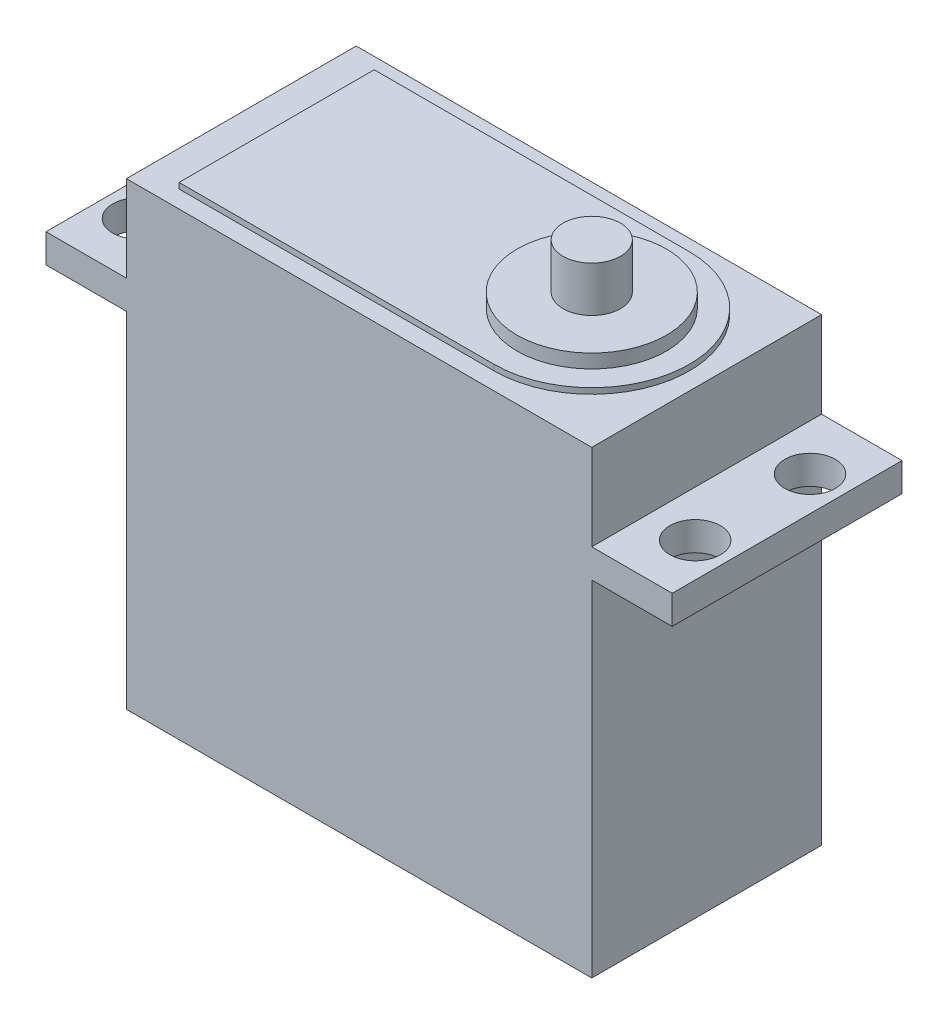
from build123d import *

# Parameters (mm, degrees)
SKETCH_1_W          = 40.5
SKETCH_1_H          = 20
EXTRUDE_1_DEPTH     = 30
SKETCH_2_W          = 54.5
SKETCH_2_H          = 20
EXTRUDE_2_DEPTH     = 2.5
SKETCH_3_W          = 40.5
SKETCH_3_H          = 20
EXTRUDE_3_DEPTH     = 7.5
EXTRUDE_4_DEPTH     = 0.5
SKETCH_5_R          = 6.5
EXTRUDE_5_DEPTH     = 1.2
SKETCH_6_R          = 2.5
EXTRUDE_6_DEPTH     = 3.95
SKETCH_7_R          = 2.2
CUT_EXTRUDE_1_DEPTH = 3.95


with BuildPart() as part:
    # 草图1 → 凸台-拉伸1 (new body)
    with BuildSketch(Plane(origin=(0, 0, 0), x_dir=(1, 0, 0), z_dir=(0, 1, 0))):
        with Locations((20.25, -10)):
            Rectangle(SKETCH_1_W, SKETCH_1_H)
    extrude(amount=EXTRUDE_1_DEPTH)

    # 草图2 → 凸台-拉伸2 (add)
    with BuildSketch(Plane(origin=(0, 30, 0), x_dir=(1, 0, 0), z_dir=(0, 1, 0))):
        with Locations((20.25, -10)):
            Rectangle(SKETCH_2_W, SKETCH_2_H)
    extrude(amount=EXTRUDE_2_DEPTH)

    # 草图3 → 凸台-拉伸3 (add)
    with BuildSketch(Plane(origin=(0, 32.5, 0), x_dir=(1, 0, 0), z_dir=(0, 1, 0))):
        with Locations((20.25, -10)):
            Rectangle(SKETCH_3_W, SKETCH_3_H)
    extrude(amount=EXTRUDE_3_DEPTH)

    # 草图4 → 凸台-拉伸4 (add)
    with BuildSketch(Plane(origin=(0, 40, 0), x_dir=(1, 0, 0), z_dir=(0, 1, 0))):
        with BuildLine():
            Line((3.073030725, -18.492151614), (30.5, -18.492151614))
            ThreePointArc((30.5, -18.492151614), (22.007848386, -10), (30.5, -1.507848386))
            Line((30.5, -1.507848386), (3.073030725, -1.507848386))
            Line((3.073030725, -1.507848386), (3.073030725, -18.492151614))
        make_face()
        with BuildLine():
            Line((30.5, -18.492151614), (30.5, -10))
            Line((30.5, -10), (30.5, -1.507848386))
            ThreePointArc((30.5, -1.507848386), (22.007848386, -10), (30.5, -18.492151614))
        make_face()
        with BuildLine():
            Line((30.5, -1.507848386), (30.5, -10))
            Line((30.5, -10), (38.992151614, -10))
            ThreePointArc((38.992151614, -10), (36.504857993, -3.995142007), (30.5, -1.507848386))
        make_face()
        with BuildLine():
            Line((38.992151614, -10), (30.5, -10))
            Line((30.5, -10), (30.5, -18.492151614))
            ThreePointArc((30.5, -18.492151614), (36.504857993, -16.004857993), (38.992151614, -10))
        make_face()
    extrude(amount=EXTRUDE_4_DEPTH)

    # 草图5 → 凸台-拉伸5 (add)
    with BuildSketch(Plane(origin=(0, 40.5, 0), x_dir=(1, 0, 0), z_dir=(0, 1, 0))):
        with Locations(Location((30.5, -10, 0), (0, 0, 270))):
            Circle(SKETCH_5_R)
    extrude(amount=EXTRUDE_5_DEPTH)

    # 草图6 → 凸台-拉伸6 (add)
    with BuildSketch(Plane(origin=(0, 41.7, 0), x_dir=(1, 0, 0), z_dir=(0, 1, 0))):
        with Locations(Location((30.5, -10, 0), (0, 0, 270))):
            Circle(SKETCH_6_R)
    extrude(amount=EXTRUDE_6_DEPTH)

    # 草图7 → 切除-拉伸1 (cut)
    with BuildSketch(Plane(origin=(0, 32.5, 0), x_dir=(1, 0, 0), z_dir=(0, 1, 0))):
        with Locations(Location((44.5, -5, 0), (0, 0, 270))):
            Circle(SKETCH_7_R)
        with Locations(Location((44.5, -15, 0), (0, 0, 270))):
            Circle(SKETCH_7_R)
        with Locations(Location((-4, -5, 0), (0, 0, 270))):
            Circle(SKETCH_7_R)
        with Locations(Location((-4, -15, 0), (0, 0, 270))):
            Circle(SKETCH_7_R)
    extrude(amount=-CUT_EXTRUDE_1_DEPTH, mode=Mode.SUBTRACT)


solid = part.part
